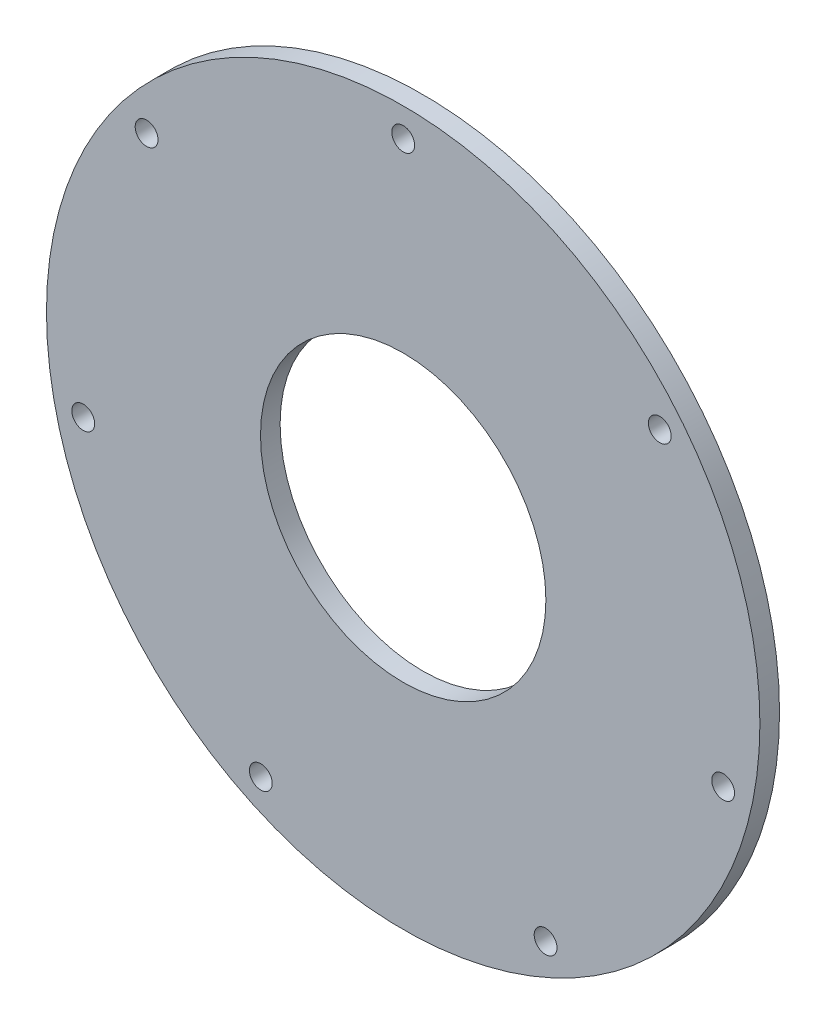
from build123d import *

# Parameters (mm, degrees)
SKIZZE1_R                        = 50
SKIZZE1_R_2                      = 20
AUFSATZ_LINEAR_AUSTRAGEN1_DEPTH  = 2.75
F_3_2_3_2_DURCHMESSER_BOHRUNG1_D = 3.2
KREISMUSTER1_COUNT               = 7


with BuildPart() as part:
    # Skizze1 → Aufsatz-Linear austragen1 (new body)
    with BuildSketch(Plane.XY):
        Circle(SKIZZE1_R)
        Circle(SKIZZE1_R_2, mode=Mode.SUBTRACT)
    extrude(amount=AUFSATZ_LINEAR_AUSTRAGEN1_DEPTH)

    # Ø3.2 (3.2) Durchmesser Bohrung1 (through all)
    with Locations(Plane.XY.offset(2.75)):
        with Locations((0, 46)):
            f_3_2_3_2_durchmesser_bohrung1 = Hole(F_3_2_3_2_DURCHMESSER_BOHRUNG1_D / 2)

    # Kreismuster1: Ø3.2 (3.2) Durchmesser Bohrung1 ×7 about axis
    kreismuster1_axis = Axis((0, 0, 0), (0, 0, 1))
    for i in range(1, KREISMUSTER1_COUNT):
        add(f_3_2_3_2_durchmesser_bohrung1.rotate(kreismuster1_axis, i * 360 / KREISMUSTER1_COUNT), mode=Mode.SUBTRACT)


solid = part.part
